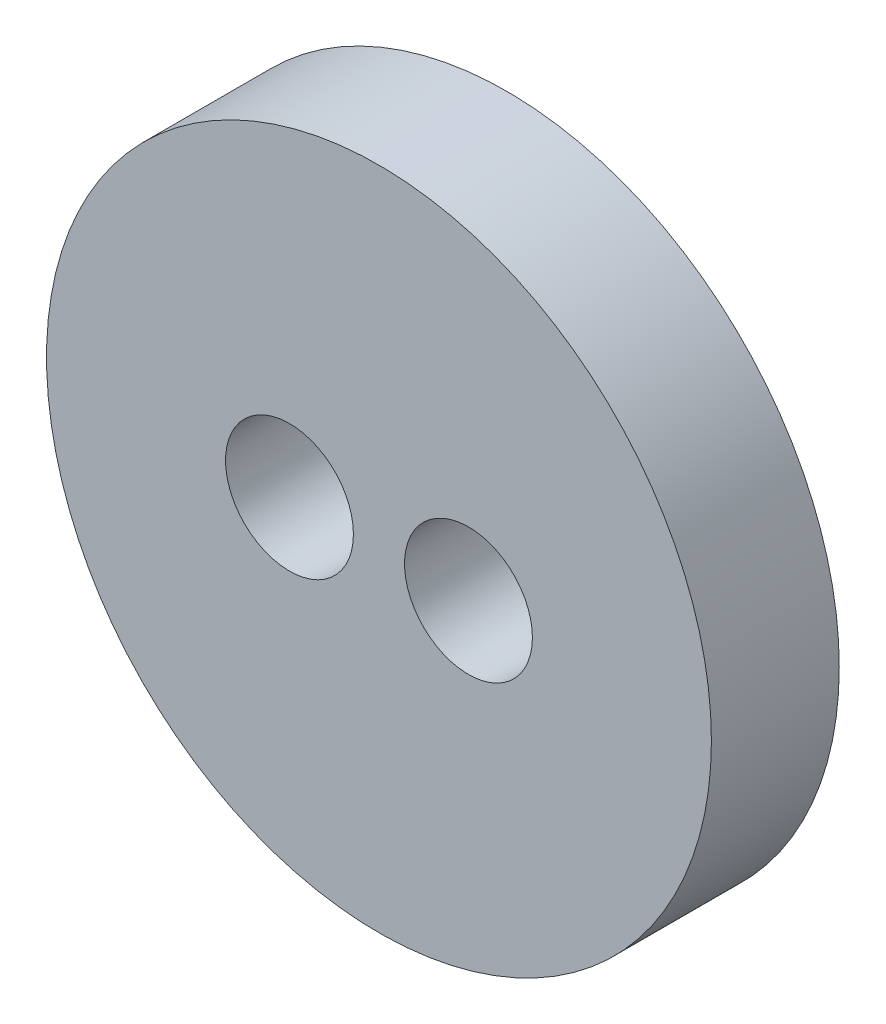
from build123d import *

# Parameters (mm, degrees)
SKETCH1_R           = 5.2
SKETCH1_R_2         = 1
BOSS_EXTRUDE1_DEPTH = 2


with BuildPart() as part:
    # Sketch1 → Boss-Extrude1 (new body)
    with BuildSketch(Plane.XY):
        Circle(SKETCH1_R)
        with Locations((1.4, 0)):
            Circle(SKETCH1_R_2, mode=Mode.SUBTRACT)
        with Locations((-1.4, 0)):
            Circle(SKETCH1_R_2, mode=Mode.SUBTRACT)
    extrude(amount=BOSS_EXTRUDE1_DEPTH)


solid = part.part
